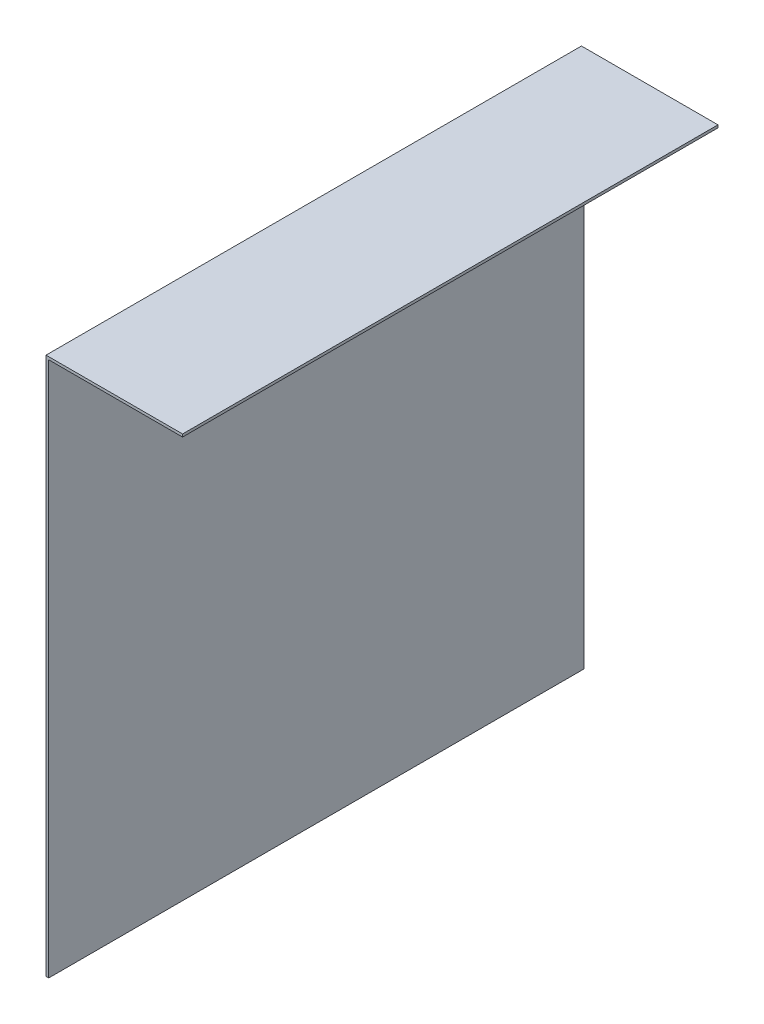
from build123d import *

# Parameters (mm, degrees)
SALIENTE_EXTRUIR1_DEPTH = 600


with BuildPart() as part:
    # Croquis1 → Saliente-Extruir1 (new body)
    with BuildSketch(Plane.XY):
        Polygon((0, 0), (0, 600), (150, 600), (150, 603), (-3, 603), (-3, 0), align=None)
    extrude(amount=SALIENTE_EXTRUIR1_DEPTH)


solid = part.part
